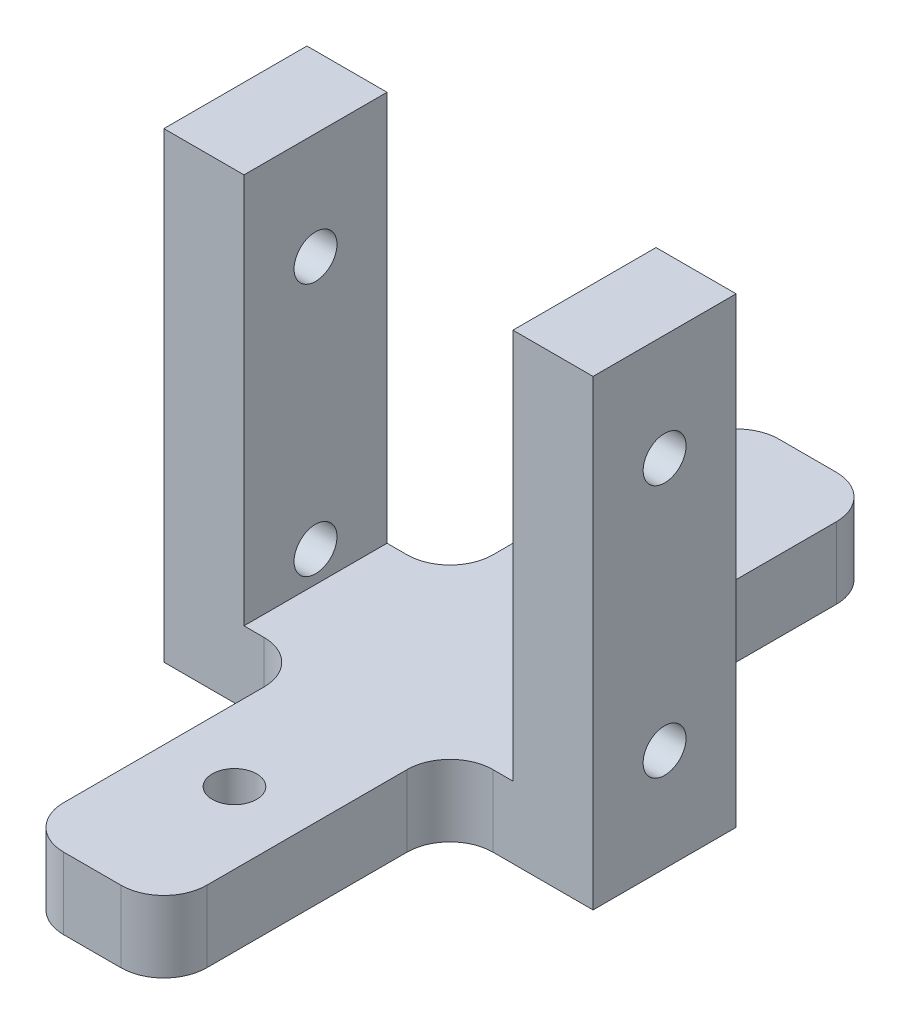
from build123d import *

# Parameters (mm, degrees)
SKETCH1_W                      = 30
SKETCH1_H                      = 10
BOSS_EXTRUDE1_DEPTH            = 5
SKETCH2_W                      = 5.6
SKETCH2_H                      = 10
BOSS_EXTRUDE2_DEPTH            = 27.3
CUT_EXTRUDE1_REACH             = 49.484
SKETCH3_R                      = 1.5
CUT_EXTRUDE1_DIRECTION_2_REACH = 49.484
SKETCH4_W                      = 10
SKETCH4_H                      = 5
BOSS_EXTRUDE3_DEPTH            = 20
SKETCH5_W                      = 10
SKETCH5_H                      = 5
BOSS_EXTRUDE4_DEPTH            = 20
SKETCH6_R                      = 1.55
CUT_EXTRUDE2_DEPTH             = 62.172994556
FILLET1_R                      = 3


with BuildPart() as part:
    # Sketch1 → Boss-Extrude1 (new body)
    with BuildSketch(Plane(origin=(0, 0, 0), x_dir=(1, 0, 0), z_dir=(0, 1, 0))):
        with Locations((-16.432463279, 19.820146309)):
            Rectangle(SKETCH1_W, SKETCH1_H)
    extrude(amount=BOSS_EXTRUDE1_DEPTH)

    # Sketch2 → Boss-Extrude2 (add)
    with BuildSketch(Plane(origin=(0, 5, 0), x_dir=(1, 0, 0), z_dir=(0, 1, 0))):
        with Locations((-28.632463279, 19.820146309)):
            Rectangle(SKETCH2_W, SKETCH2_H)
        with Locations((-4.232463279, 19.820146309)):
            Rectangle(SKETCH2_W, SKETCH2_H)
    extrude(amount=BOSS_EXTRUDE2_DEPTH)

    # Cut-Extrude1: up to this face of the body (flat: up to its plane)
    cut_extrude1_end = Plane(part.part.faces().sort_by_distance((-31.432463279, 16.15, -19.820146309))[0])
    # Sketch3 → Cut-Extrude1 (cut, up to the picked face)
    with BuildSketch(Plane(origin=(-25.832463279, 0, 0), x_dir=(0, 0, -1), z_dir=(1, 0, 0)), mode=Mode.PRIVATE) as cut_extrude1_sk1:
        with Locations((19.820146309, 7.15)):
            Circle(SKETCH3_R)
    cut_extrude1_tool1 = split(extrude(cut_extrude1_sk1.sketch, amount=-CUT_EXTRUDE1_REACH, mode=Mode.PRIVATE), bisect_by=cut_extrude1_end, keep=Keep.BOTH, mode=Mode.PRIVATE)
    # Sketch3 → Cut-Extrude1 (cut, up to the picked face)
    with BuildSketch(Plane(origin=(-25.832463279, 0, 0), x_dir=(0, 0, -1), z_dir=(1, 0, 0)), mode=Mode.PRIVATE) as cut_extrude1_sk2:
        with Locations((19.820146309, 24.85)):
            Circle(SKETCH3_R)
    cut_extrude1_tool2 = split(extrude(cut_extrude1_sk2.sketch, amount=-CUT_EXTRUDE1_REACH, mode=Mode.PRIVATE), bisect_by=cut_extrude1_end, keep=Keep.BOTH, mode=Mode.PRIVATE)
    add(cut_extrude1_tool1.solids().sort_by(Axis((-25.832463, 7.15, -19.820146), (-1, 0, 0)))[0], mode=Mode.SUBTRACT)
    add(cut_extrude1_tool2.solids().sort_by(Axis((-25.832463, 24.85, -19.820146), (-1, 0, 0)))[0], mode=Mode.SUBTRACT)

    # Cut-Extrude1 direction 2: up to this face of the body (flat: up to its plane)
    cut_extrude1_direction_2_end = Plane(part.part.faces().sort_by_distance((-1.432463279, 16.15, -19.820146309))[0])
    # Sketch3 → Cut-Extrude1 direction 2 (cut, up to the picked face)
    with BuildSketch(Plane(origin=(-25.832463279, 0, 0), x_dir=(0, 0, -1), z_dir=(1, 0, 0)), mode=Mode.PRIVATE) as cut_extrude1_direction_2_sk1:
        with Locations((19.820146309, 7.15)):
            Circle(SKETCH3_R)
    cut_extrude1_direction_2_tool1 = split(extrude(cut_extrude1_direction_2_sk1.sketch, amount=CUT_EXTRUDE1_DIRECTION_2_REACH, mode=Mode.PRIVATE), bisect_by=cut_extrude1_direction_2_end, keep=Keep.BOTH, mode=Mode.PRIVATE)
    # Sketch3 → Cut-Extrude1 direction 2 (cut, up to the picked face)
    with BuildSketch(Plane(origin=(-25.832463279, 0, 0), x_dir=(0, 0, -1), z_dir=(1, 0, 0)), mode=Mode.PRIVATE) as cut_extrude1_direction_2_sk2:
        with Locations((19.820146309, 24.85)):
            Circle(SKETCH3_R)
    cut_extrude1_direction_2_tool2 = split(extrude(cut_extrude1_direction_2_sk2.sketch, amount=CUT_EXTRUDE1_DIRECTION_2_REACH, mode=Mode.PRIVATE), bisect_by=cut_extrude1_direction_2_end, keep=Keep.BOTH, mode=Mode.PRIVATE)
    add(cut_extrude1_direction_2_tool1.solids().sort_by(Axis((-25.832463, 7.15, -19.820146), (1, 0, 0)))[0], mode=Mode.SUBTRACT)
    add(cut_extrude1_direction_2_tool2.solids().sort_by(Axis((-25.832463, 24.85, -19.820146), (1, 0, 0)))[0], mode=Mode.SUBTRACT)

    # Sketch4 → Boss-Extrude3 (add)
    with BuildSketch(Plane(origin=(0, 0, -24.820146309), x_dir=(-1, 0, 0), z_dir=(0, 0, -1))):
        with Locations((16.432463279, 2.5)):
            Rectangle(SKETCH4_W, SKETCH4_H)
    extrude(amount=BOSS_EXTRUDE3_DEPTH)

    # Sketch5 → Boss-Extrude4 (add)
    with BuildSketch(Plane.XY.offset(-14.820146309)):
        with Locations((-16.432463279, 2.5)):
            Rectangle(SKETCH5_W, SKETCH5_H)
    extrude(amount=BOSS_EXTRUDE4_DEPTH)

    # Sketch6 → Cut-Extrude2 (cut, through all)
    with BuildSketch(Plane(origin=(0, 5, 0), x_dir=(1, 0, 0), z_dir=(0, 1, 0))):
        with Locations(Location((-16.432463279, 34.885731697, 0), (0, 0, 270))):
            Circle(SKETCH6_R)
        with Locations(Location((-16.432463279, 4.754560921, 0), (0, 0, 270))):
            Circle(SKETCH6_R)
    extrude(amount=-CUT_EXTRUDE2_DEPTH, mode=Mode.SUBTRACT)

    # Fillet1
    fillet1_edges = [part.edges().sort_by_distance(p)[0] for p in [
        (-21.432463279, 2.5, -24.820146309),
        (-21.432463279, 2.5, -44.820146309),
        (-11.432463279, 2.5, -44.820146309),
        (-11.432463279, 2.5, -24.820146309),
        (-11.432463279, 2.5, -14.820146309),
        (-21.432463279, 2.5, -14.820146309),
        (-11.432463279, 2.5, 5.179853691),
        (-21.432463279, 2.5, 5.179853691),
    ]]
    fillet(fillet1_edges, radius=FILLET1_R)


solid = part.part
